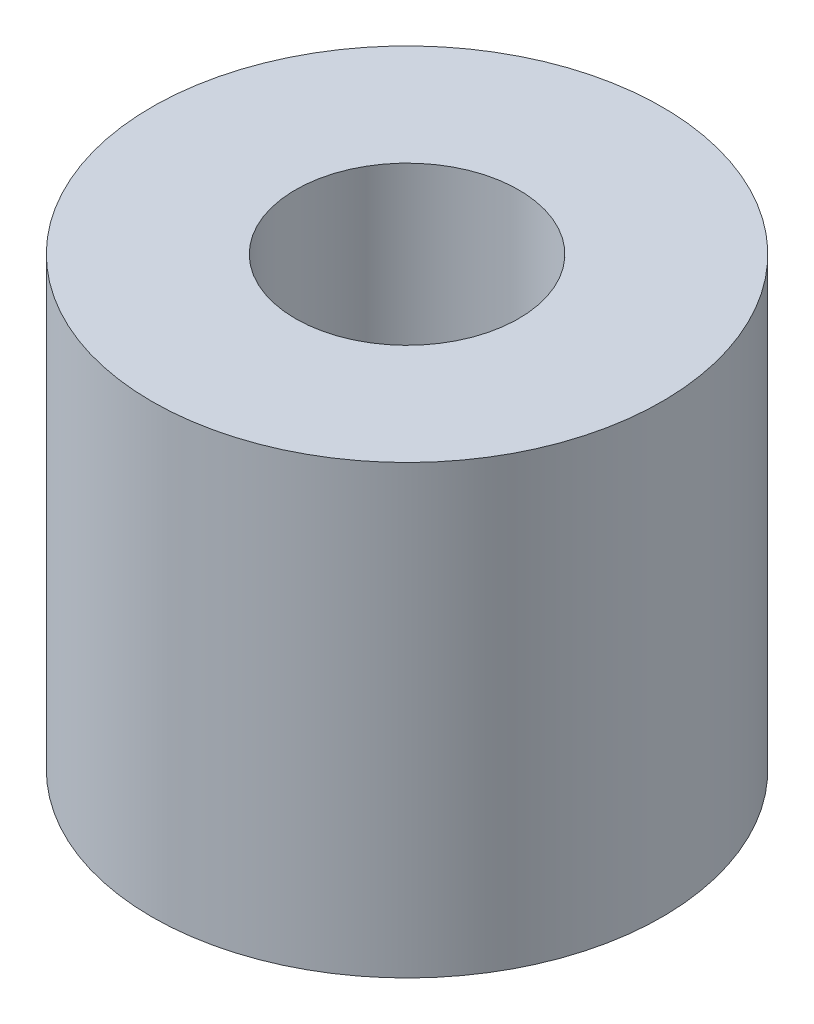
from build123d import *

# Parameters (mm, degrees)
SKETCH_1_R      = 4
SKETCH_1_R_2    = 1.75
EXTRUDE_1_DEPTH = 7


with BuildPart() as part:
    # 草图1 → 凸台-拉伸1 (new body)
    with BuildSketch(Plane(origin=(0, 0, 0), x_dir=(1, 0, 0), z_dir=(0, 1, 0))):
        with Locations(Location((0, 0, 0), (0, 0, 270))):
            Circle(SKETCH_1_R)
        with Locations(Location((0, 0, 0), (0, 0, 270))):
            Circle(SKETCH_1_R_2, mode=Mode.SUBTRACT)
    extrude(amount=EXTRUDE_1_DEPTH)


solid = part.part
